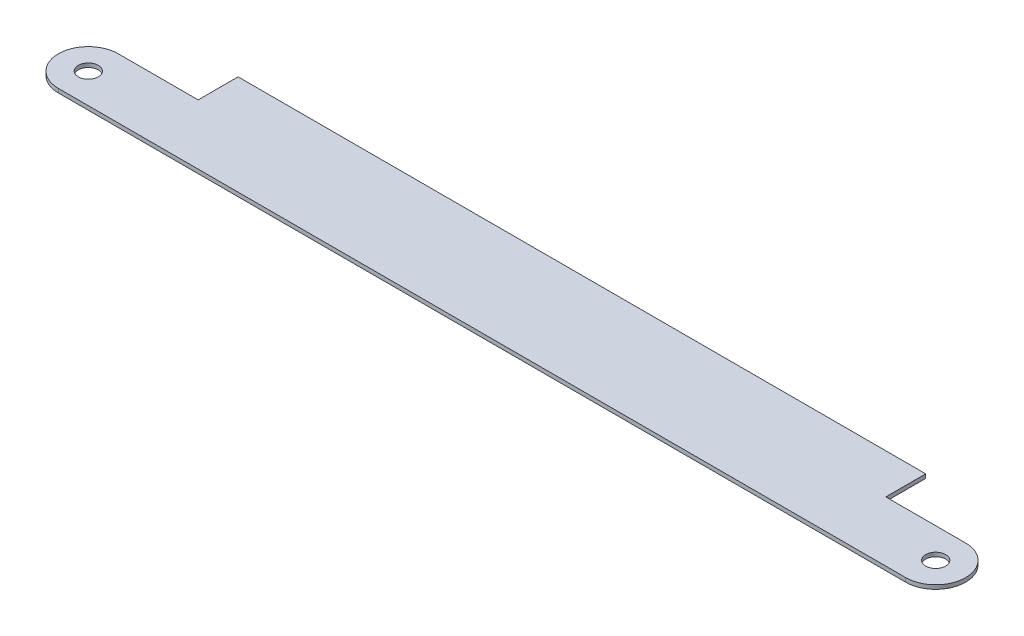
from build123d import *

# Parameters (mm, degrees)
SKETCH1_R           = 2.5
BOSS_EXTRUDE1_DEPTH = 1


with BuildPart() as part:
    # Sketch1 → Boss-Extrude1 (new body)
    with BuildSketch(Plane(origin=(0, 0, 0), x_dir=(1, 0, 0), z_dir=(0, 1, 0))):
        with BuildLine():
            Line((0, 7.5), (20, 7.5))
            Line((20, 7.5), (20, 17.5))
            Line((20, 17.5), (192.13, 17.5))
            Line((192.13, 17.5), (192.13, 7.5))
            Line((192.13, 7.5), (212.13, 7.5))
            ThreePointArc((212.13, 7.5), (219.63, 0), (212.13, -7.5))
            Line((212.13, -7.5), (0, -7.5))
            ThreePointArc((0, -7.5), (-7.5, 0), (0, 7.5))
        make_face()
        with Locations(Location((0, 0, 0), (0, 0, 270))):
            Circle(SKETCH1_R, mode=Mode.SUBTRACT)
        with Locations(Location((212.13, 0, 0), (0, 0, 270))):
            Circle(SKETCH1_R, mode=Mode.SUBTRACT)
    extrude(amount=BOSS_EXTRUDE1_DEPTH)


solid = part.part
